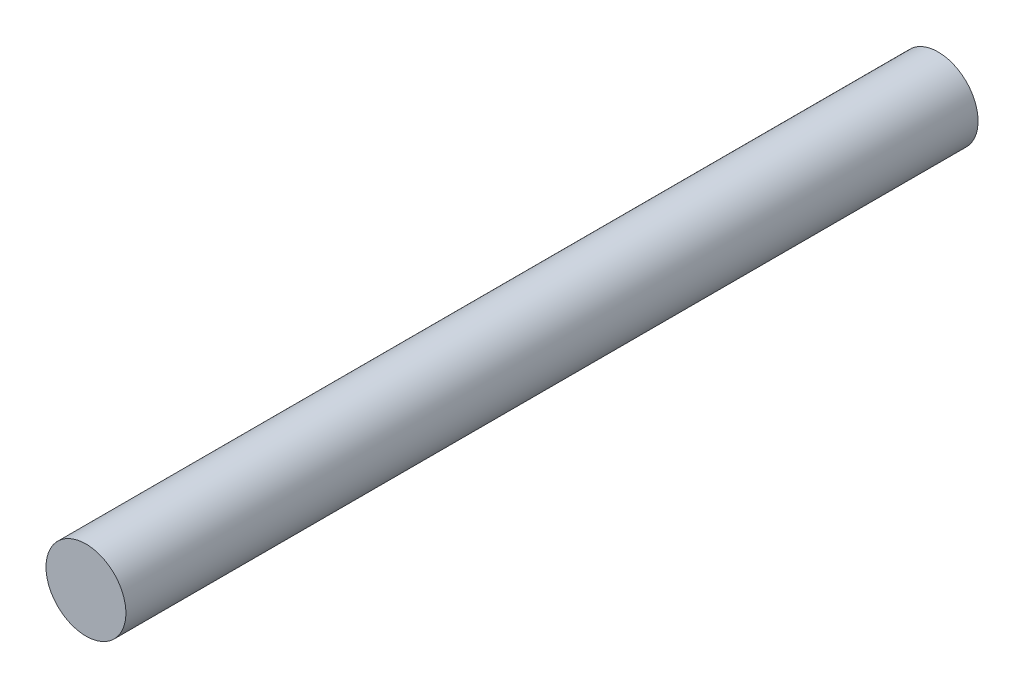
from build123d import *

# Parameters (mm, degrees)
SKETCH2_R           = 14.2875
BOSS_EXTRUDE1_DEPTH = 304.8


with BuildPart() as part:
    # Sketch2 → Boss-Extrude1 (new body)
    with BuildSketch(Plane.XY):
        with Locations(Location((0, 0, 0), (0, 0, 180))):
            Circle(SKETCH2_R)
    extrude(amount=BOSS_EXTRUDE1_DEPTH)


solid = part.part
